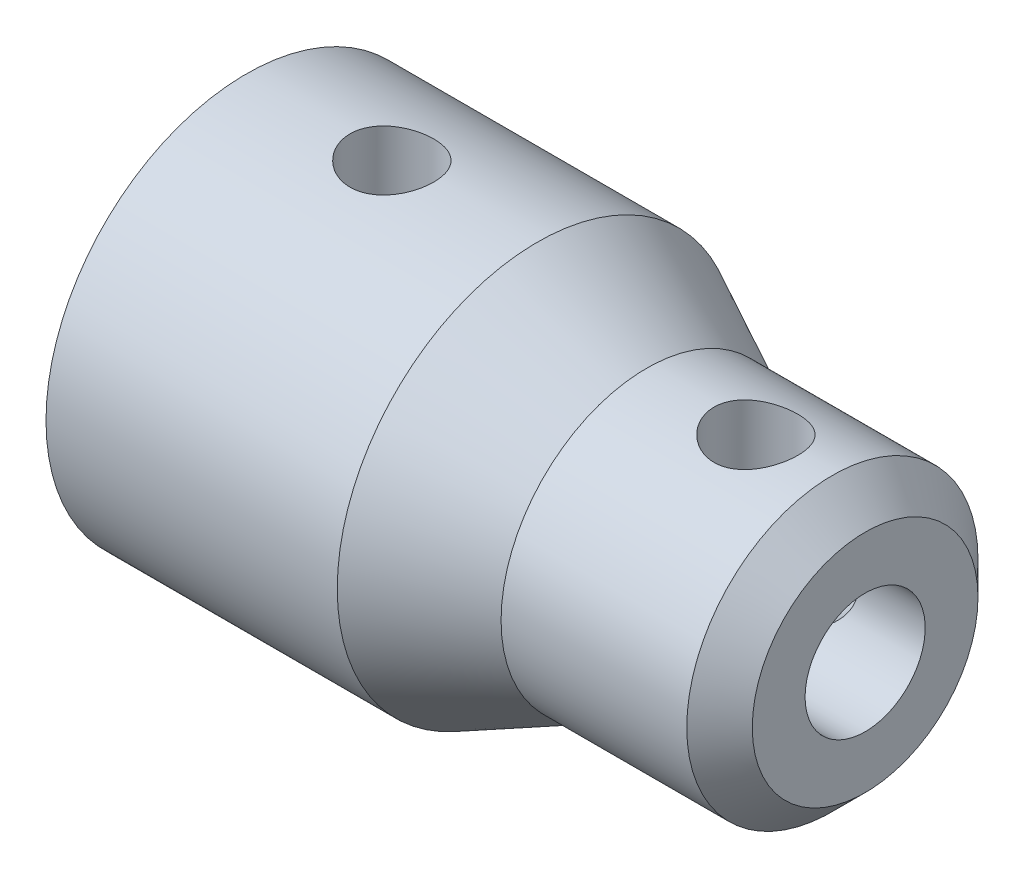
from build123d import *

# Parameters (mm, degrees)
SKETCH2_R          = 1.4605
CUT_EXTRUDE1_DEPTH = 16.107129112
CIRPATTERN1_COUNT  = 2
CIRPATTERN1_ANGLE  = 90
CHAMFER1_SIZE      = 1.143


with BuildPart() as part:
    # Sketch1 → Revolve1 (revolve)
    with BuildSketch(Plane(origin=(0, 0, 0), x_dir=(1, 0, 0), z_dir=(0, 1, 0)), mode=Mode.PRIVATE) as revolve1_sk:
        Polygon((-10.16, 3.4036), (0, 3.4036), (1.905, 2.0955), (11.43, 2.0955), (11.43, 5.08), (3.81, 5.08), (0, 6.985), (-10.16, 6.985), align=None)
    revolve(revolve1_sk.sketch.rotate(Axis((0, 0, 0), (1, 0, 0)), 180), axis=Axis((0, 0, 0), (1, 0, 0)))

    # Sketch2 → Cut-Extrude1 (cut, through all)
    with BuildSketch(Plane(origin=(0, 0, 0), x_dir=(1, 0, 0), z_dir=(0, 1, 0))):
        with Locations(Location((-5.08, 0, 0), (0, 0, 90))):
            Circle(SKETCH2_R)
        with Locations(Location((7.62, 0, 0), (0, 0, 90))):
            Circle(SKETCH2_R)
    cut_extrude1 = extrude(amount=CUT_EXTRUDE1_DEPTH, mode=Mode.SUBTRACT)

    # CirPattern1: Cut-Extrude1 ×2 about axis
    cirpattern1_axis = Axis((-10.16, 0, 0), (-1, 0, 0))
    for i in range(1, CIRPATTERN1_COUNT):
        add(cut_extrude1.rotate(cirpattern1_axis, i * CIRPATTERN1_ANGLE / (CIRPATTERN1_COUNT - 1)), mode=Mode.SUBTRACT)

    # Chamfer1
    chamfer1_edges = [part.edges().sort_by_distance(p)[0] for p in [
        (11.43, 0, -5.08),
    ]]
    chamfer(chamfer1_edges, length=CHAMFER1_SIZE)


solid = part.part
